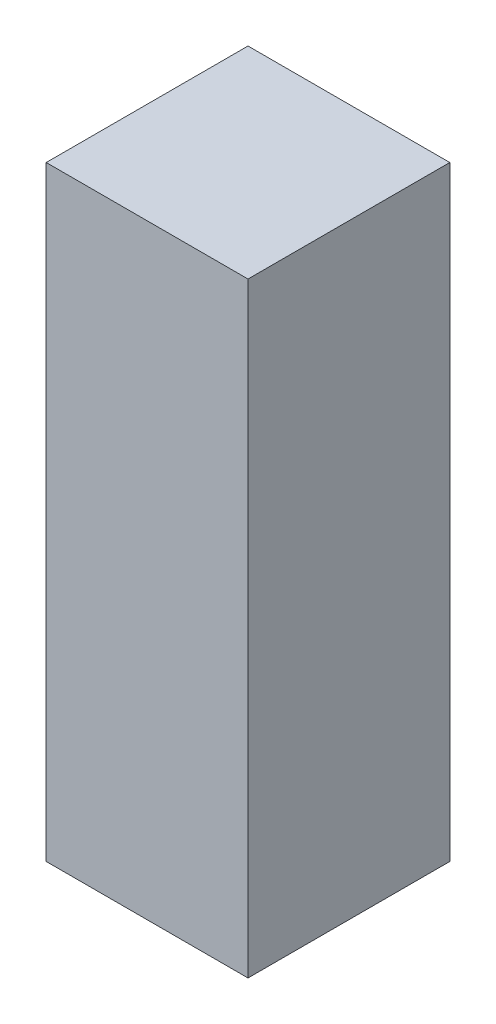
from build123d import *

# Parameters (mm, degrees)
SKETCH_1_W      = 25
SKETCH_1_H      = 25
EXTRUDE_1_DEPTH = 75


with BuildPart() as part:
    # 草图1 → 凸台-拉伸1 (new body)
    with BuildSketch(Plane(origin=(0, 0, 0), x_dir=(1, 0, 0), z_dir=(0, 1, 0))):
        with Locations((12.5, 12.5)):
            Rectangle(SKETCH_1_W, SKETCH_1_H)
    extrude(amount=EXTRUDE_1_DEPTH)


solid = part.part
